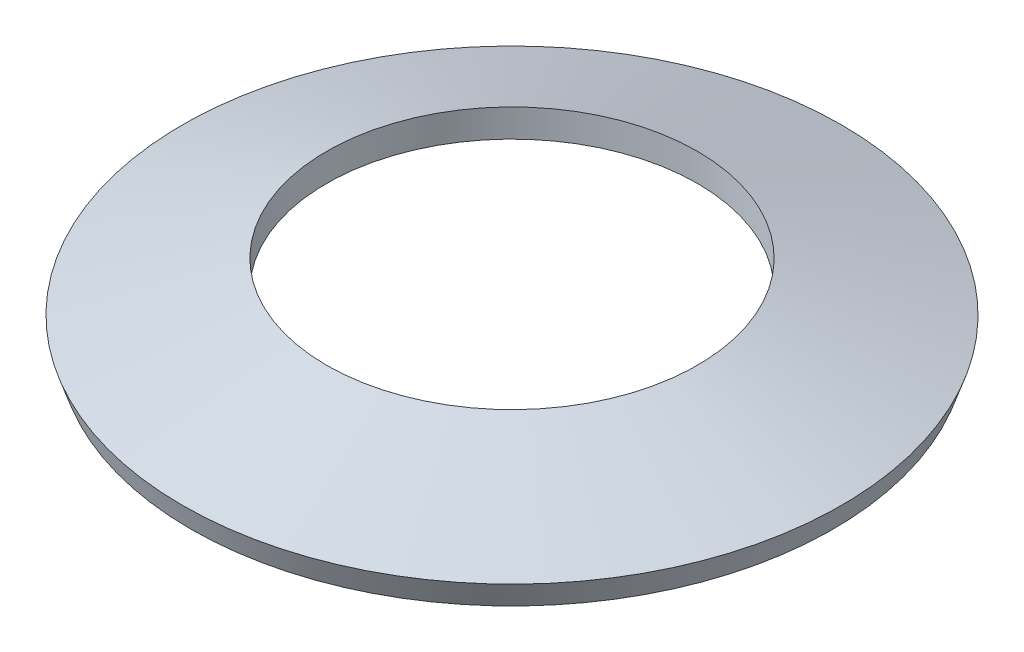
from build123d import *


with BuildPart() as part:
    # Esquisse1 → Révolution1 (revolve)
    with BuildSketch(Plane(origin=(0, 0, 10.400028379), x_dir=(-1, 0, 0), z_dir=(0, 0, -1)), mode=Mode.PRIVATE) as r_volution1_sk:
        Polygon((-44.97521693, -18.531434822), (-44.768533471, -19.13714263), (-41.47521693, -18.013376277), (-41.47521693, -17.33714263), align=None)
    revolve(r_volution1_sk.sketch.rotate(Axis((36.97521693, -19.160570604, 10.400028379), (0, 1, 0)), 270), axis=Axis((36.97521693, -19.160570604, 10.400028379), (0, 1, 0)))


solid = part.part
